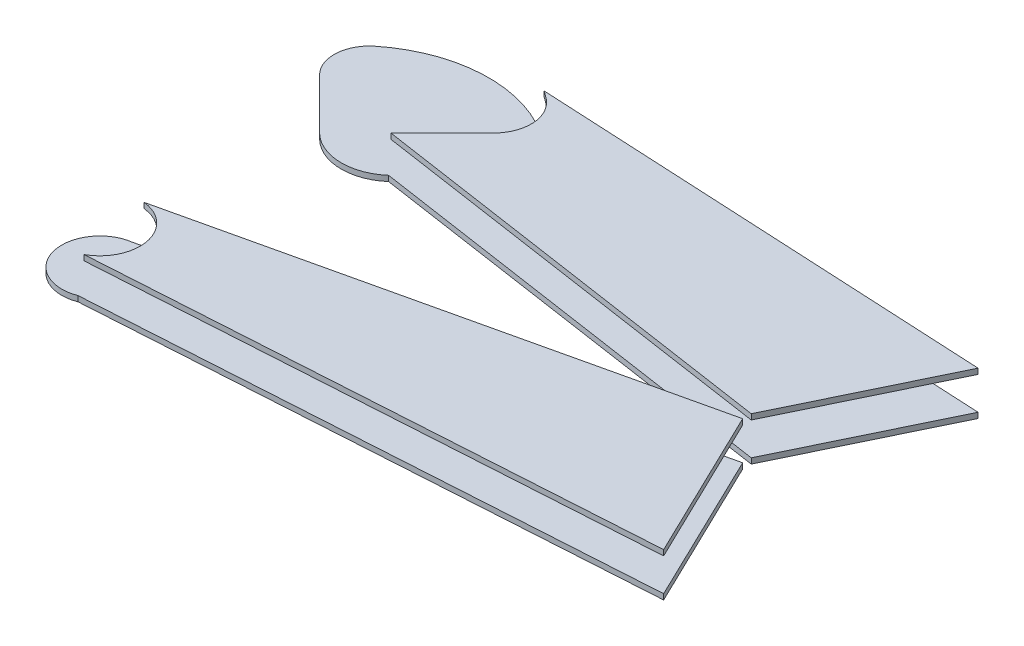
from build123d import *

# Parameters (mm, degrees)
BOSS_EXTRUDE1_START   = -172.974
BOSS_EXTRUDE1_DEPTH   = 6.35
BOSS_EXTRUDE1_2_DEPTH = 6.35
BOSS_EXTRUDE2_START   = -122.174
BOSS_EXTRUDE2_DEPTH   = 6.35
BOSS_EXTRUDE2_2_DEPTH = 6.35
SKETCH3_R             = 46.83
CUT_EXTRUDE2_DEPTH    = 883.340554687


with BuildPart() as part:
    # Sketch1 → Boss-Extrude1 (new body)
    with BuildSketch(Plane(origin=(0, 0, 0), x_dir=(1, 0, 0), z_dir=(0, 1, 0)).offset(BOSS_EXTRUDE1_START)):
        with BuildLine():
            Line((-97, 183), (-183, 5))
            Line((-183, 5), (-679.005377884, 78.745496881))
            ThreePointArc((-679.005377884, 78.745496881), (-721.152914741, 63.770418633), (-762.17817844, 81.591629872))
            Line((-762.17817844, 81.591629872), (-820.56615944, 139.979610872))
            ThreePointArc((-820.56615944, 139.979610872), (-832.505230927, 171.163078474), (-817.268436033, 200.874863358))
            ThreePointArc((-817.268436033, 200.874863358), (-726.992188174, 235.256713622), (-633.705018706, 210.16853777))
            Line((-633.705018706, 210.16853777), (-97, 183))
        make_face()
    extrude(amount=BOSS_EXTRUDE1_DEPTH)


with BuildPart() as body_2:
    # Sketch1 → Boss-Extrude1 2 (new body)
    with BuildSketch(Plane(origin=(0, 0, 0), x_dir=(1, 0, 0), z_dir=(0, 1, 0)).offset(BOSS_EXTRUDE1_START)):
        with BuildLine():
            Line((-97, -183), (-183, -5))
            Line((-183, -5), (-760.286009912, -137.771927086))
            ThreePointArc((-760.286009912, -137.771927086), (-797.579364145, -192.822794387), (-738.485290066, -223.306932381))
            Line((-738.485290066, -223.306932381), (-97, -183))
        make_face()
    extrude(amount=BOSS_EXTRUDE1_2_DEPTH)


with BuildPart() as body_3:
    # Sketch1<2> → Boss-Extrude2 (new body)
    with BuildSketch(Plane(origin=(0, 0, 0), x_dir=(1, 0, 0), z_dir=(0, 1, 0)).offset(BOSS_EXTRUDE2_START)):
        with BuildLine():
            Line((-97, 183), (-183, 5))
            Line((-183, 5), (-679.005377884, 78.745496881))
            ThreePointArc((-679.005377884, 78.745496881), (-721.152914741, 63.770418633), (-762.17817844, 81.591629872))
            Line((-762.17817844, 81.591629872), (-820.56615944, 139.979610872))
            ThreePointArc((-820.56615944, 139.979610872), (-832.505230927, 171.163078474), (-817.268436033, 200.874863358))
            ThreePointArc((-817.268436033, 200.874863358), (-726.992188174, 235.256713622), (-633.705018706, 210.16853777))
            Line((-633.705018706, 210.16853777), (-97, 183))
        make_face()
    extrude(amount=-BOSS_EXTRUDE2_DEPTH)


with BuildPart() as body_4:
    # Sketch1<2> → Boss-Extrude2 2 (new body)
    with BuildSketch(Plane(origin=(0, 0, 0), x_dir=(1, 0, 0), z_dir=(0, 1, 0)).offset(BOSS_EXTRUDE2_START)):
        with BuildLine():
            Line((-97, -183), (-183, -5))
            Line((-183, -5), (-760.286009912, -137.771927086))
            ThreePointArc((-760.286009912, -137.771927086), (-797.579364145, -192.822794387), (-738.485290066, -223.306932381))
            Line((-738.485290066, -223.306932381), (-97, -183))
        make_face()
    extrude(amount=-BOSS_EXTRUDE2_2_DEPTH)


with BuildPart() as cut_extrude2_tool:
    # Sketch3 → Cut-Extrude2 (new, through all)
    with BuildSketch(Plane(origin=(0, 0, 0), x_dir=(1, 0, 0), z_dir=(0, 1, 0))):
        with Locations((-754.506388348, -181.844577047)):
            Circle(SKETCH3_R)
        with BuildLine():
            Line((-674.274642491, 79.908715733), (-615.886661491, 138.296696732))
            ThreePointArc((-615.886661491, 138.296696732), (-603.25398635, 171.291776492), (-619.37596705, 202.729675721))
            ThreePointArc((-619.37596705, 202.729675721), (-719.067867535, 237.83718636), (-818.75976802, 202.729675721))
            ThreePointArc((-818.75976802, 202.729675721), (-834.88174872, 171.291776492), (-822.249073579, 138.296696732))
            Line((-822.249073579, 138.296696732), (-763.86109258, 79.908715733))
            ThreePointArc((-763.86109258, 79.908715733), (-719.067867535, 61.354754417), (-674.274642491, 79.908715733))
        make_face()
    extrude(amount=-CUT_EXTRUDE2_DEPTH)


with BuildPart() as body_4_1:
    add(body_4.part)

    # Cut-Extrude2: cut by cut_extrude2_tool
    add(cut_extrude2_tool.part, mode=Mode.SUBTRACT)


with BuildPart() as body_3_1:
    add(body_3.part)

    # Cut-Extrude2: cut by cut_extrude2_tool
    add(cut_extrude2_tool.part, mode=Mode.SUBTRACT)


solid = Compound([part.part, body_2.part, body_4_1.part, body_3_1.part])
